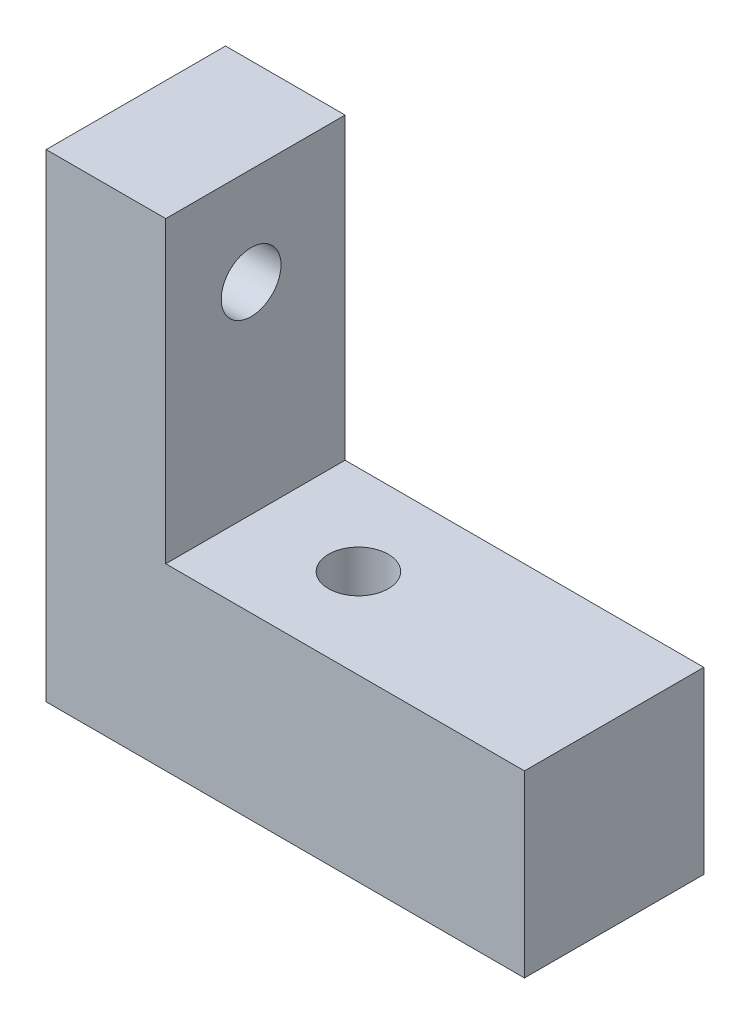
from build123d import *

# Parameters (mm, degrees)
BOSS_EXTRUDE1_DEPTH = 30
SKETCH2_R           = 5
CUT_EXTRUDE1_DEPTH  = 30
SKETCH3_R           = 5
CUT_EXTRUDE2_DEPTH  = 30


with BuildPart() as part:
    # Sketch1 → Boss-Extrude1 (new body)
    with BuildSketch(Plane.XY):
        Polygon((0, 0), (80, 0), (80, 30), (20, 30), (20, 80), (0, 80), (0, 30), align=None)
    extrude(amount=BOSS_EXTRUDE1_DEPTH)

    # Sketch2 → Cut-Extrude1 (cut)
    with BuildSketch(Plane(origin=(0, 30, 0), x_dir=(1, 0, 0), z_dir=(0, 1, 0))):
        with Locations(Location((37.228400761, -15, 0), (0, 0, 270))):
            Circle(SKETCH2_R)
    extrude(amount=-CUT_EXTRUDE1_DEPTH, mode=Mode.SUBTRACT)

    # Sketch3 → Cut-Extrude2 (cut)
    with BuildSketch(Plane(origin=(20, 0, 0), x_dir=(0, 0, -1), z_dir=(1, 0, 0))):
        with Locations((-15.722617001, 63.664041554)):
            Circle(SKETCH3_R)
    extrude(amount=-CUT_EXTRUDE2_DEPTH, mode=Mode.SUBTRACT)


solid = part.part
